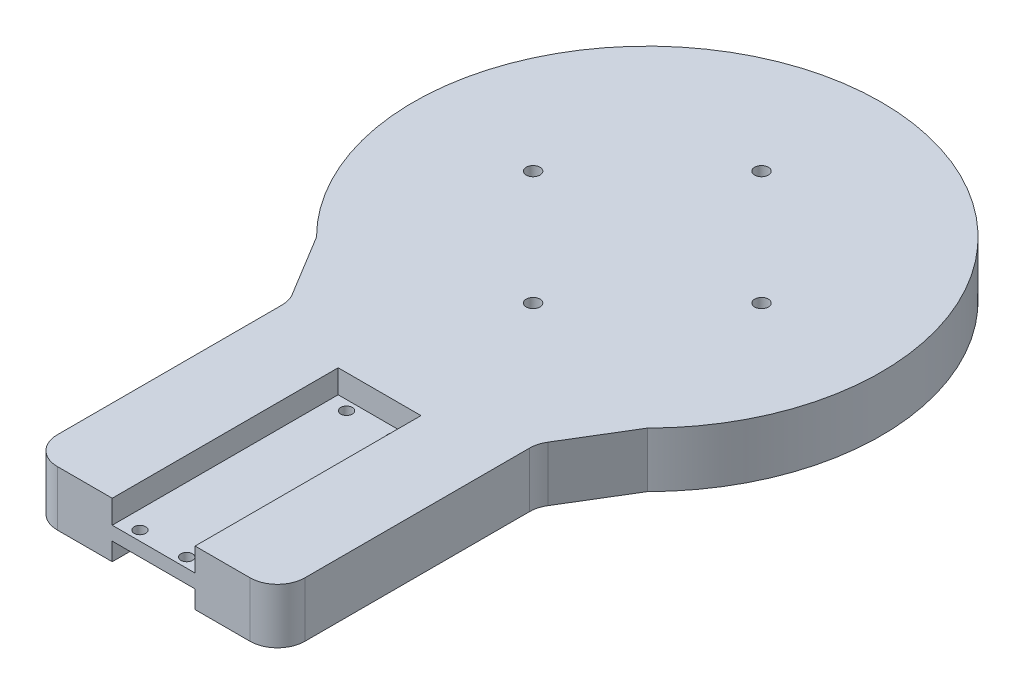
from build123d import *

# Parameters (mm, degrees)
SKETCH1_R           = 2.5
BOSS_EXTRUDE1_DEPTH = 20
SKETCH2_W           = 30.1
SKETCH2_H           = 82.1
CUT_EXTRUDE1_DEPTH  = 8.5
SKETCH3_W           = 30.1
SKETCH3_H           = 82.1
CUT_EXTRUDE2_DEPTH  = 6.5
CUT_EXTRUDE3_REACH  = 200.842
SKETCH5_R           = 2.1


with BuildPart() as part:
    # Sketch1 → Boss-Extrude1 (new body)
    with BuildSketch(Plane(origin=(0, 0, 0), x_dir=(1, 0, 0), z_dir=(0, 1, 0))):
        with BuildLine():
            Line((60.104076401, -60.104076401), (46.450402953, -82.609312867))
            ThreePointArc((46.450402953, -82.609312867), (45.36942446, -85.103300576), (45, -87.796257086))
            Line((45, -87.796257086), (45, -118.89))
            Line((45, -118.89), (45, -169.39))
            ThreePointArc((45, -169.39), (42.071067812, -176.461067812), (35, -179.39))
            Line((35, -179.39), (-35, -179.39))
            ThreePointArc((-35, -179.39), (-42.071067812, -176.461067812), (-45, -169.39))
            Line((-45, -169.39), (-45, -118.89))
            Line((-45, -118.89), (-45, -87.796257086))
            ThreePointArc((-45, -87.796257086), (-45.36942446, -85.103300576), (-46.450402953, -82.609312867))
            Line((-46.450402953, -82.609312867), (-60.104076401, -60.104076401))
            ThreePointArc((-60.104076401, -60.104076401), (0, 85), (60.104076401, -60.104076401))
        make_face()
        with Locations(Location((0, 41.5, 0), (0, 0, 270))):
            Circle(SKETCH1_R, mode=Mode.SUBTRACT)
        with Locations(Location((41.5, 0, 0), (0, 0, 270))):
            Circle(SKETCH1_R, mode=Mode.SUBTRACT)
        with Locations(Location((0, -41.5, 0), (0, 0, 270))):
            Circle(SKETCH1_R, mode=Mode.SUBTRACT)
        with Locations(Location((-41.5, 0, 0), (0, 0, 270))):
            Circle(SKETCH1_R, mode=Mode.SUBTRACT)
    extrude(amount=BOSS_EXTRUDE1_DEPTH)

    # Sketch2 → Cut-Extrude1 (cut)
    with BuildSketch(Plane(origin=(0, 20, 0), x_dir=(1, 0, 0), z_dir=(0, 1, 0))):
        with Locations((0, -138.34)):
            Rectangle(SKETCH2_W, SKETCH2_H)
    extrude(amount=-CUT_EXTRUDE1_DEPTH, mode=Mode.SUBTRACT)

    # Sketch3 → Cut-Extrude2 (cut)
    with BuildSketch(Plane.XZ):
        with Locations((0, 138.34)):
            Rectangle(SKETCH3_W, SKETCH3_H)
    extrude(amount=-CUT_EXTRUDE2_DEPTH, mode=Mode.SUBTRACT)

    # Sketch5 → Cut-Extrude3 (cut, up to next)
    with BuildSketch(Plane(origin=(0, 11.5, 0), x_dir=(1, 0, 0), z_dir=(0, 1, 0)), mode=Mode.PRIVATE) as cut_extrude3_sk1:
        with Locations(Location((-8.5, -100.8, 0), (0, 0, 270))):
            Circle(SKETCH5_R)
    cut_extrude3_tool1 = extrude(cut_extrude3_sk1.sketch, amount=-CUT_EXTRUDE3_REACH, mode=Mode.PRIVATE) & part.part
    # Sketch5 → Cut-Extrude3 (cut, up to next)
    with BuildSketch(Plane(origin=(0, 11.5, 0), x_dir=(1, 0, 0), z_dir=(0, 1, 0)), mode=Mode.PRIVATE) as cut_extrude3_sk2:
        with Locations(Location((8.5, -100.8, 0), (0, 0, 270))):
            Circle(SKETCH5_R)
    cut_extrude3_tool2 = extrude(cut_extrude3_sk2.sketch, amount=-CUT_EXTRUDE3_REACH, mode=Mode.PRIVATE) & part.part
    # Sketch5 → Cut-Extrude3 (cut, up to next)
    with BuildSketch(Plane(origin=(0, 11.5, 0), x_dir=(1, 0, 0), z_dir=(0, 1, 0)), mode=Mode.PRIVATE) as cut_extrude3_sk3:
        with Locations(Location((8.5, -175.88, 0), (0, 0, 90))):
            Circle(SKETCH5_R)
    cut_extrude3_tool3 = extrude(cut_extrude3_sk3.sketch, amount=-CUT_EXTRUDE3_REACH, mode=Mode.PRIVATE) & part.part
    # Sketch5 → Cut-Extrude3 (cut, up to next)
    with BuildSketch(Plane(origin=(0, 11.5, 0), x_dir=(1, 0, 0), z_dir=(0, 1, 0)), mode=Mode.PRIVATE) as cut_extrude3_sk4:
        with Locations(Location((-8.5, -175.88, 0), (0, 0, 90))):
            Circle(SKETCH5_R)
    cut_extrude3_tool4 = extrude(cut_extrude3_sk4.sketch, amount=-CUT_EXTRUDE3_REACH, mode=Mode.PRIVATE) & part.part
    add(cut_extrude3_tool1.solids().sort_by_distance((-8.5, 11.5, 100.8))[0], mode=Mode.SUBTRACT)
    add(cut_extrude3_tool2.solids().sort_by_distance((8.5, 11.5, 100.8))[0], mode=Mode.SUBTRACT)
    add(cut_extrude3_tool3.solids().sort_by_distance((8.5, 11.5, 175.88))[0], mode=Mode.SUBTRACT)
    add(cut_extrude3_tool4.solids().sort_by_distance((-8.5, 11.5, 175.88))[0], mode=Mode.SUBTRACT)


solid = part.part
